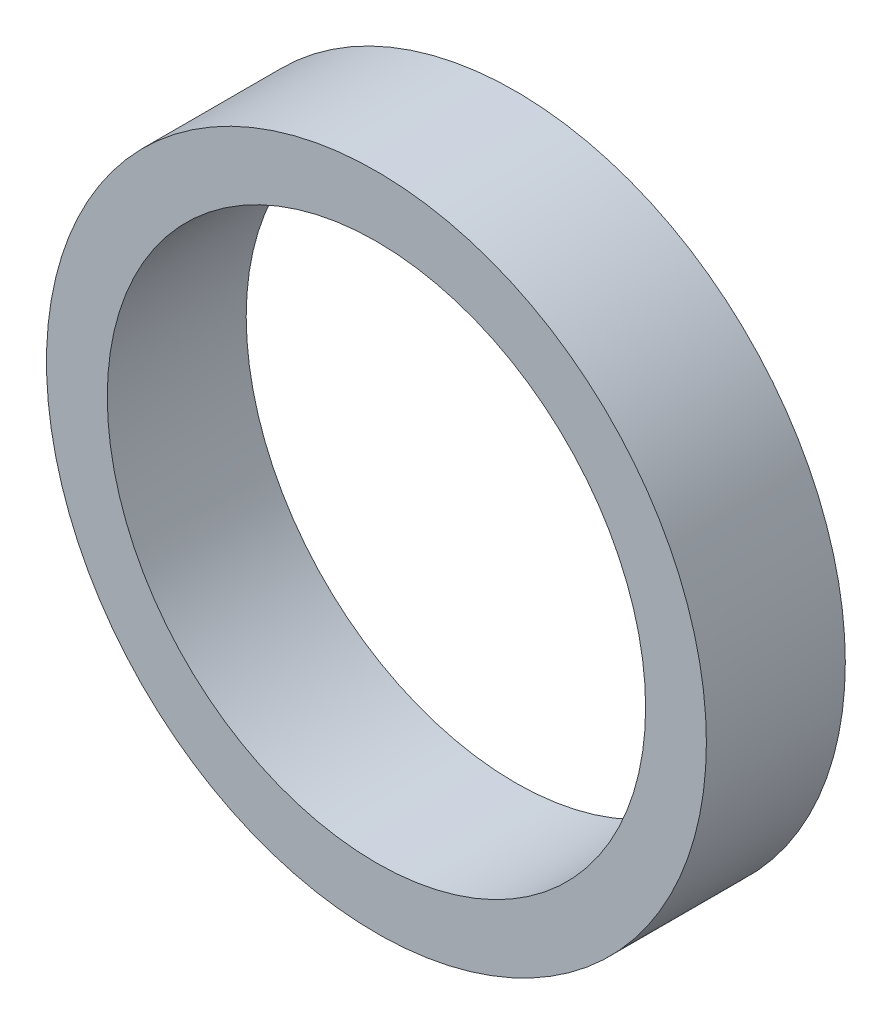
from build123d import *

# Parameters (mm, degrees)
ESQUISSE1_R        = 19
ESQUISSE1_R_2      = 15.5
BOSS_EXTRU_1_DEPTH = 8


with BuildPart() as part:
    # Esquisse1 → Boss.-Extru.1 (new body)
    with BuildSketch(Plane.XY):
        Circle(ESQUISSE1_R)
        Circle(ESQUISSE1_R_2, mode=Mode.SUBTRACT)
    extrude(amount=BOSS_EXTRU_1_DEPTH)


solid = part.part
